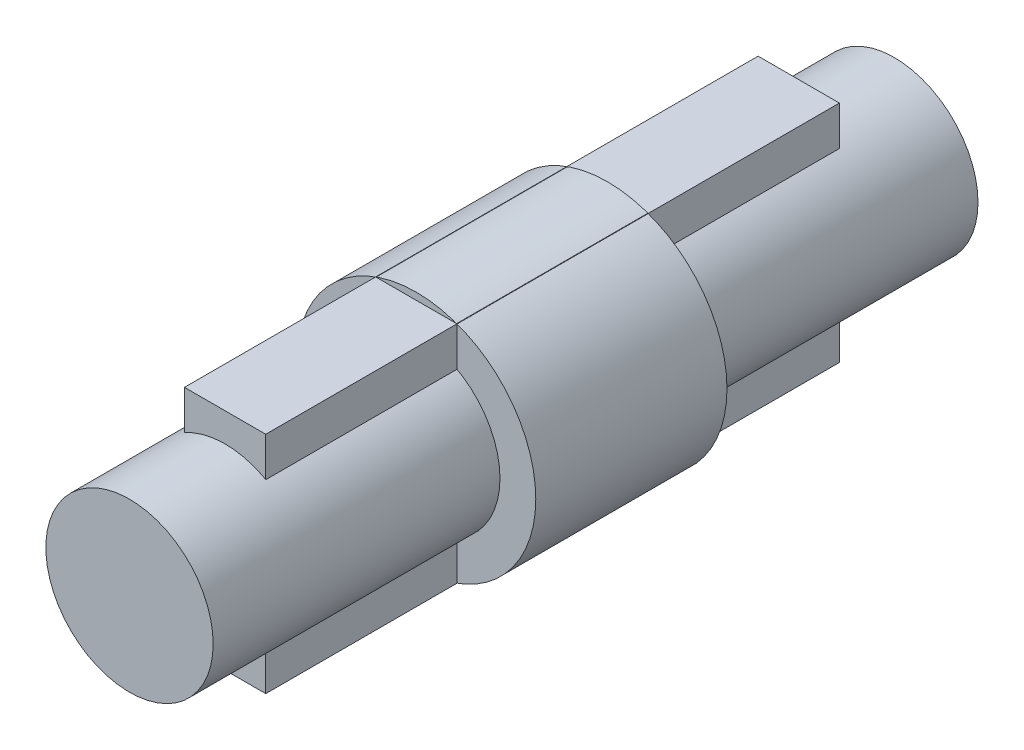
from build123d import *

# Parameters (mm, degrees)
SKETCH1_R           = 2.4989998
BOSS_EXTRUDE1_DEPTH = 2
SKETCH1_4_W         = 1.7
SKETCH1_4_H         = 4.7
BOSS_EXTRUDE2_DEPTH = 6
SKETCH1_5_R         = 1.75
BOSS_EXTRUDE3_DEPTH = 8


with BuildPart() as part:
    # Sketch1 → Boss-Extrude1 (new, symmetric)
    with BuildSketch(Plane.XY):
        Circle(SKETCH1_R)
    extrude(amount=BOSS_EXTRUDE1_DEPTH, both=True)


with BuildPart() as body_2:
    # Sketch1<4> → Boss-Extrude2 (new, symmetric)
    with BuildSketch(Plane.XY):
        Rectangle(SKETCH1_4_W, SKETCH1_4_H)
    extrude(amount=BOSS_EXTRUDE2_DEPTH, both=True)


with BuildPart() as body_3:
    # Sketch1<5> → Boss-Extrude3 (new, symmetric)
    with BuildSketch(Plane.XY):
        Circle(SKETCH1_5_R)
    extrude(amount=BOSS_EXTRUDE3_DEPTH, both=True)


solid = Compound([part.part, body_2.part, body_3.part])
